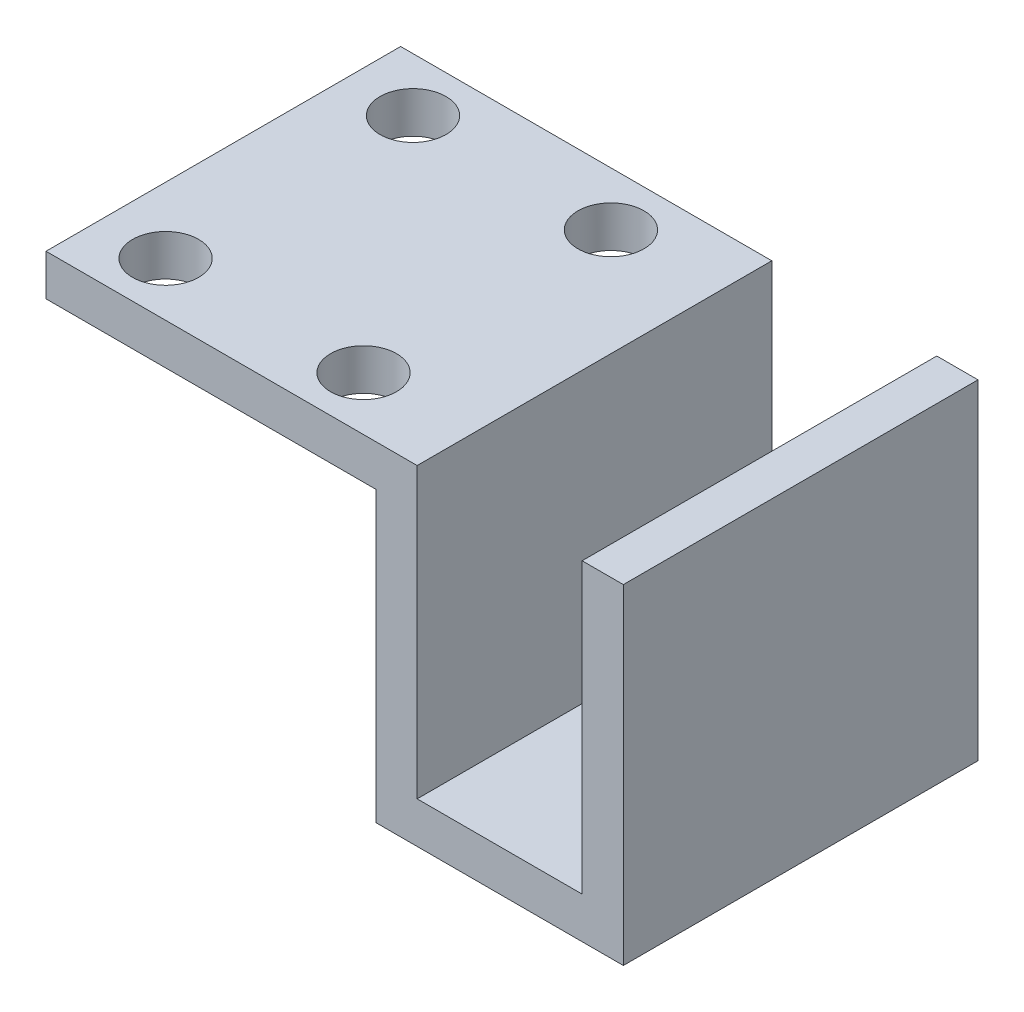
from build123d import *

# Parameters (mm, degrees)
BOSS_EXTRUDE1_DEPTH = 43
SKETCH2_R           = 4
CUT_EXTRUDE2_DEPTH  = 10


with BuildPart() as part:
    # Sketch1 → Boss-Extrude1 (new body)
    with BuildSketch(Plane.XY):
        Polygon((0, 0), (40, 0), (40, -35), (70, -35), (70, 5), (65, 5), (65, -30), (45, -30), (45, 5), (0, 5), align=None)
    extrude(amount=BOSS_EXTRUDE1_DEPTH)

    # Sketch2 → Cut-Extrude2 (cut)
    with BuildSketch(Plane.XZ):
        with Locations(Location((8, 36.5, 0), (0, 0, 270))):
            Circle(SKETCH2_R)
        with Locations(Location((32, 36.5, 0), (0, 0, 270))):
            Circle(SKETCH2_R)
        with Locations(Location((32, 6.5, 0), (0, 0, 270))):
            Circle(SKETCH2_R)
        with Locations(Location((8, 6.5, 0), (0, 0, 270))):
            Circle(SKETCH2_R)
    extrude(amount=-CUT_EXTRUDE2_DEPTH, mode=Mode.SUBTRACT)


solid = part.part
